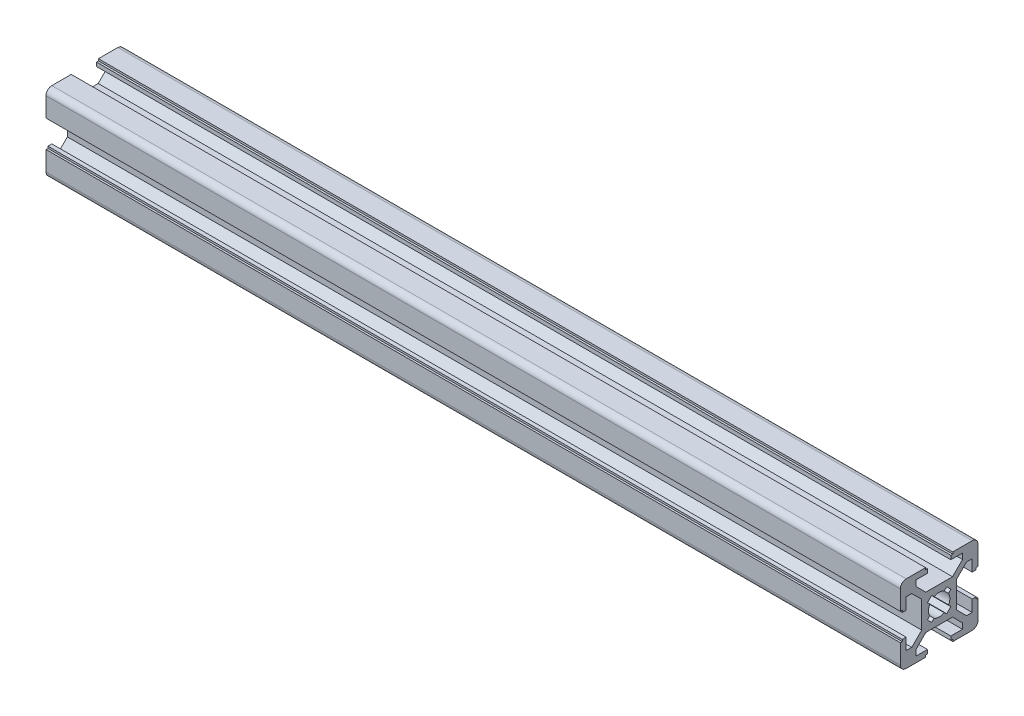
from build123d import *

# Parameters (mm, degrees)
BR_EXTRUDE_DEPTH      = 110
BR_EXTRUDE_DEPTH_BACK = 110


with BuildPart() as part:
    # Sketch2 → BR_Extrude (new, two sides: drawn at the far end of the back side and taken through both)
    with BuildSketch(Plane(origin=(0, 0, 0), x_dir=(0, 0, -1), z_dir=(1, 0, 0)).offset(-BR_EXTRUDE_DEPTH_BACK)):
        with BuildLine():
            Line((-7.060660172, -6), (-8.5, -6))
            Line((-8.5, -6), (-8.5, -3))
            Line((-8.5, -3), (-9.5, -3))
            Line((-9.5, -3), (-9.5, -3.5))
            Line((-9.5, -3.5), (-10, -3.5))
            Line((-10, -3.5), (-10, -8.5))
            ThreePointArc((-10, -8.5), (-9.560660172, -9.560660172), (-8.5, -10))
            Line((-8.5, -10), (-3.5, -10))
            Line((-3.5, -10), (-3.5, -9.5))
            Line((-3.5, -9.5), (-3, -9.5))
            Line((-3, -9.5), (-3, -8.5))
            Line((-3, -8.5), (-6, -8.5))
            Line((-6, -8.5), (-6, -7.060660172))
            Line((-6, -7.060660172), (-3.439339828, -4.5))
            Line((-3.439339828, -4.5), (3.439339828, -4.5))
            Line((3.439339828, -4.5), (6, -7.060660172))
            Line((6, -7.060660172), (6, -8.5))
            Line((6, -8.5), (3, -8.5))
            Line((3, -8.5), (3, -9.5))
            Line((3, -9.5), (3.5, -9.5))
            Line((3.5, -9.5), (3.5, -10))
            Line((3.5, -10), (8.5, -10))
            ThreePointArc((8.5, -10), (9.560660172, -9.560660172), (10, -8.5))
            Line((10, -8.5), (10, -3.5))
            Line((10, -3.5), (9.5, -3.5))
            Line((9.5, -3.5), (9.5, -3))
            Line((9.5, -3), (8.5, -3))
            Line((8.5, -3), (8.5, -6))
            Line((8.5, -6), (7.060660172, -6))
            Line((7.060660172, -6), (4.5, -3.439339828))
            Line((4.5, -3.439339828), (4.5, 3.439339828))
            Line((4.5, 3.439339828), (7.060660172, 6))
            Line((7.060660172, 6), (8.5, 6))
            Line((8.5, 6), (8.5, 3))
            Line((8.5, 3), (9.5, 3))
            Line((9.5, 3), (9.5, 3.5))
            Line((9.5, 3.5), (10, 3.5))
            Line((10, 3.5), (10, 8.5))
            ThreePointArc((10, 8.5), (9.560660172, 9.560660172), (8.5, 10))
            Line((8.5, 10), (3.5, 10))
            Line((3.5, 10), (3.5, 9.5))
            Line((3.5, 9.5), (3, 9.5))
            Line((3, 9.5), (3, 8.5))
            Line((3, 8.5), (6, 8.5))
            Line((6, 8.5), (6, 7.060660172))
            Line((6, 7.060660172), (3.439339828, 4.5))
            Line((3.439339828, 4.5), (-3.439339828, 4.5))
            Line((-3.439339828, 4.5), (-6, 7.060660172))
            Line((-6, 7.060660172), (-6, 8.5))
            Line((-6, 8.5), (-3, 8.5))
            Line((-3, 8.5), (-3, 9.5))
            Line((-3, 9.5), (-3.5, 9.5))
            Line((-3.5, 9.5), (-3.5, 10))
            Line((-3.5, 10), (-8.5, 10))
            ThreePointArc((-8.5, 10), (-9.560660172, 9.560660172), (-10, 8.5))
            Line((-10, 8.5), (-10, 3.5))
            Line((-10, 3.5), (-9.5, 3.5))
            Line((-9.5, 3.5), (-9.5, 3))
            Line((-9.5, 3), (-8.5, 3))
            Line((-8.5, 3), (-8.5, 6))
            Line((-8.5, 6), (-7.060660172, 6))
            Line((-7.060660172, 6), (-4.5, 3.439339828))
            Line((-4.5, 3.439339828), (-4.5, -3.439339828))
            Line((-4.5, -3.439339828), (-7.060660172, -6))
        make_face()
        with BuildLine():
            Line((-3.000174203, -1.949573265), (-2.435636363, -1.276783266))
            ThreePointArc((-2.435636363, -1.276783266), (-2.75, 0), (-2.435636363, 1.276783266))
            Line((-2.435636363, 1.276783266), (-3.000174203, 1.949573265))
            Line((-3.000174203, 1.949573265), (-1.949573265, 3.000174203))
            Line((-1.949573265, 3.000174203), (-1.276783266, 2.435636363))
            ThreePointArc((-1.276783266, 2.435636363), (0, 2.75), (1.276783266, 2.435636363))
            Line((1.276783266, 2.435636363), (1.949573265, 3.000174203))
            Line((1.949573265, 3.000174203), (3.000174203, 1.949573265))
            Line((3.000174203, 1.949573265), (2.435636363, 1.276783266))
            ThreePointArc((2.435636363, 1.276783266), (2.75, 0), (2.435636363, -1.276783266))
            Line((2.435636363, -1.276783266), (3.000174203, -1.949573265))
            Line((3.000174203, -1.949573265), (1.949573265, -3.000174203))
            Line((1.949573265, -3.000174203), (1.276783266, -2.435636363))
            ThreePointArc((1.276783266, -2.435636363), (0, -2.75), (-1.276783266, -2.435636363))
            Line((-1.276783266, -2.435636363), (-1.949573265, -3.000174203))
            Line((-1.949573265, -3.000174203), (-3.000174203, -1.949573265))
        make_face(mode=Mode.SUBTRACT)
    extrude(amount=BR_EXTRUDE_DEPTH + BR_EXTRUDE_DEPTH_BACK)


solid = part.part
